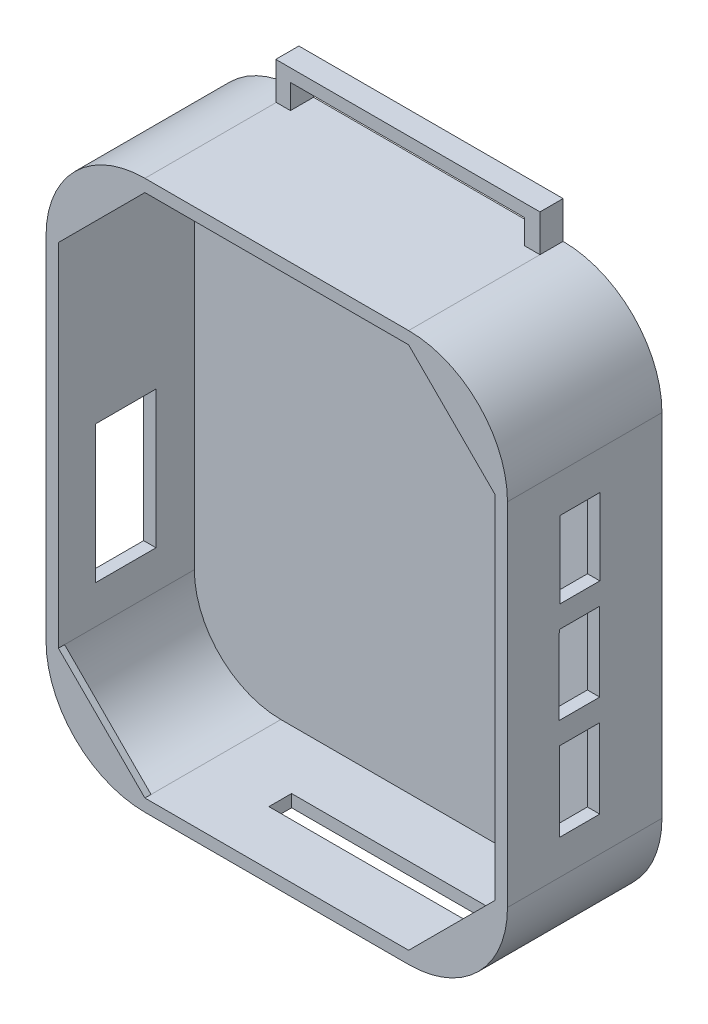
from build123d import *

# Parameters (mm, degrees)
EXTRUDE_2_DEPTH      = 1.5
EXTRUDE_4_DEPTH      = 11
EXTRUDE_START        = -0.5
EXTRUDE_7_DEPTH      = 0.5
EXTRUDE_8_DEPTH      = 0.5
EXTRUDE_9_DEPTH      = 0.5
SKETCH_12_W          = 4.897675457
SKETCH_12_H          = 11.127806736
CUT_EXTRUDE_3_DEPTH  = 3
SKETCH_13_W          = 3.241108758
SKETCH_13_H          = 6.19411896
CUT_EXTRUDE_4_DEPTH  = 3
SKETCH_14_W          = 3.313133397
SKETCH_14_H          = 6.122094321
CUT_EXTRUDE_5_DEPTH  = 3
SKETCH_15_W          = 2.880985563
SKETCH_15_H          = 6.266143599
CUT_EXTRUDE_6_DEPTH  = 3
SKETCH_16_W          = 15.721601541
SKETCH_16_H          = 1.836163931
CUT_EXTRUDE_7_DEPTH  = 3
SKETCH_19_W          = 3.275209086
SKETCH_19_H          = 6.371405254
SKETCH_19_H_2        = 6.414210644
CUT_EXTRUDE_10_DEPTH = 3
EXTRUDE_10_DEPTH     = 0.5
SKETCH_21_W          = 21.34
SKETCH_21_H          = 1.867544815
EXTRUDE_11_DEPTH     = 3
SKETCH_22_W          = 18.717201221
SKETCH_22_H          = 1.991492088
CUT_EXTRUDE_12_DEPTH = 3
SKETCH_23_W          = 21.381625352
SKETCH_23_H          = 3
EXTRUDE_12_DEPTH     = 1.87
SKETCH_24_W          = 18.956438282
SKETCH_24_H          = 1.976854412
CUT_EXTRUDE_13_DEPTH = 1.87


with BuildPart() as part:
    # 草图1 → 凸台-拉伸2 (new body)
    with BuildSketch(Plane.XY):
        with BuildLine():
            Line((-10.67, 22.215), (10.67, 22.215))
            ThreePointArc((10.67, 22.215), (16.326854249, 19.871854249), (18.67, 14.215))
            Line((18.67, 14.215), (18.67, -14.215))
            ThreePointArc((18.67, -14.215), (16.326854249, -19.871854249), (10.67, -22.215))
            Line((10.67, -22.215), (-10.67, -22.215))
            ThreePointArc((-10.67, -22.215), (-16.326854249, -19.871854249), (-18.67, -14.215))
            Line((-18.67, -14.215), (-18.67, 14.215))
            ThreePointArc((-18.67, 14.215), (-16.326854249, 19.871854249), (-10.67, 22.215))
        make_face()
    extrude(amount=EXTRUDE_2_DEPTH)

    # 草图4 → 凸台-拉伸4 (add)
    with BuildSketch(Plane.XY.offset(1.5)):
        with BuildLine():
            Line((18.67, -14.215), (18.67, 14.215))
            ThreePointArc((18.67, 14.215), (16.326854249, 19.871854249), (10.67, 22.215))
            Line((10.67, 22.215), (-10.67, 22.215))
            ThreePointArc((-10.67, 22.215), (-16.326854249, 19.871854249), (-18.67, 14.215))
            Line((-18.67, 14.215), (-18.67, -14.215))
            ThreePointArc((-18.67, -14.215), (-16.326854249, -19.871854249), (-10.67, -22.215))
            Line((-10.67, -22.215), (10.67, -22.215))
            ThreePointArc((10.67, -22.215), (16.326854249, -19.871854249), (18.67, -14.215))
        make_face()
        with BuildLine():
            Line((17.67, -14.215), (17.67, 14.215))
            ThreePointArc((17.67, 14.215), (15.619747468, 19.164747468), (10.67, 21.215))
            Line((10.67, 21.215), (-10.67, 21.215))
            ThreePointArc((-10.67, 21.215), (-15.619747468, 19.164747468), (-17.67, 14.215))
            Line((-17.67, 14.215), (-17.67, -14.215))
            ThreePointArc((-17.67, -14.215), (-15.619747468, -19.164747468), (-10.67, -21.215))
            Line((-10.67, -21.215), (10.67, -21.215))
            ThreePointArc((10.67, -21.215), (15.619747468, -19.164747468), (17.67, -14.215))
        make_face(mode=Mode.SUBTRACT)
    extrude(amount=EXTRUDE_4_DEPTH)

    # 草图8 → 凸台-拉伸7 (add)
    with BuildSketch(Plane.XY.offset(12.5).offset(EXTRUDE_START)):
        with BuildLine():
            Line((-17.67, -14.215), (-10.67, -21.215))
            ThreePointArc((-10.67, -21.215), (-15.619747468, -19.164747468), (-17.67, -14.215))
        make_face()
    extrude(amount=EXTRUDE_7_DEPTH)

    # 草图9 → 凸台-拉伸8 (add)
    with BuildSketch(Plane.XY.offset(12.5).offset(EXTRUDE_START)):
        with BuildLine():
            Line((10.67, 21.215), (17.67, 14.215))
            ThreePointArc((17.67, 14.215), (15.619747468, 19.164747468), (10.67, 21.215))
        make_face()
    extrude(amount=EXTRUDE_8_DEPTH)

    # 草图10 → 凸台-拉伸9 (add)
    with BuildSketch(Plane.XY.offset(12.5).offset(EXTRUDE_START)):
        with BuildLine():
            Line((17.67, -14.215), (10.67, -21.215))
            ThreePointArc((10.67, -21.215), (15.619747468, -19.164747468), (17.67, -14.215))
        make_face()
    extrude(amount=EXTRUDE_9_DEPTH)

    # 草图12 → 切除-拉伸3 (cut)
    with BuildSketch(Plane.ZY.offset(18.67)):
        with Locations((7.050780577, -5.563903368)):
            Rectangle(SKETCH_12_W, SKETCH_12_H)
    extrude(amount=-CUT_EXTRUDE_3_DEPTH, mode=Mode.SUBTRACT)

    # 草图13 → 切除-拉伸4 (cut)
    with BuildSketch(Plane(origin=(18.67, 0, 0), x_dir=(0, 0, -1), z_dir=(1, 0, 0))):
        with Locations((-6.646601976, 8.030747256)):
            Rectangle(SKETCH_13_W, SKETCH_13_H)
    extrude(amount=-CUT_EXTRUDE_4_DEPTH, mode=Mode.SUBTRACT)

    # 草图14 → 切除-拉伸5 (cut)
    with BuildSketch(Plane(origin=(18.67, 0, 0), x_dir=(0, 0, -1), z_dir=(1, 0, 0))):
        with Locations((-6.690937152, -0.144049279)):
            Rectangle(SKETCH_14_W, SKETCH_14_H)
    extrude(amount=-CUT_EXTRUDE_5_DEPTH, mode=Mode.SUBTRACT)

    # 草图15 → 切除-拉伸6 (cut)
    with BuildSketch(Plane(origin=(18.67, 0, 0), x_dir=(0, 0, -1), z_dir=(1, 0, 0))):
        with Locations((-6.664861945, -8.210808854)):
            Rectangle(SKETCH_15_W, SKETCH_15_H)
    extrude(amount=-CUT_EXTRUDE_6_DEPTH, mode=Mode.SUBTRACT)

    # 草图16 → 切除-拉伸7 (cut)
    with BuildSketch(Plane.XZ.offset(22.215)):
        with Locations((2.809199229, 7.168081965)):
            Rectangle(SKETCH_16_W, SKETCH_16_H)
    extrude(amount=-CUT_EXTRUDE_7_DEPTH, mode=Mode.SUBTRACT)

    # 草图19 → 切除-拉伸10 (cut)
    with BuildSketch(Plane(origin=(18.67, 0, 0), x_dir=(0, 0, -1), z_dir=(1, 0, 0))):
        with Locations((-6.671974996, -0.019393812)):
            Rectangle(SKETCH_19_W, SKETCH_19_H)
        with Locations((-6.671974996, -8.200049753)):
            Rectangle(SKETCH_19_W, SKETCH_19_H_2)
    extrude(amount=-CUT_EXTRUDE_10_DEPTH, mode=Mode.SUBTRACT)

    # 草图20 → 凸台-拉伸10 (add)
    with BuildSketch(Plane.XY.offset(12.5).offset(EXTRUDE_START)):
        with BuildLine():
            Line((-10.67, 21.215), (-17.67, 14.215))
            ThreePointArc((-17.67, 14.215), (-15.619747468, 19.164747468), (-10.67, 21.215))
        make_face()
    extrude(amount=EXTRUDE_10_DEPTH)

    # 草图21 → 凸台-拉伸11 (add)
    with BuildSketch(Plane(origin=(0, -22.215, 0), x_dir=(-1, 0, 0), z_dir=(0, -1, 0))):
        with Locations((0, -0.933772408)):
            Rectangle(SKETCH_21_W, SKETCH_21_H)
    extrude(amount=EXTRUDE_11_DEPTH)

    # 草图22 → 切除-拉伸12 (cut)
    with BuildSketch(Plane.XY.offset(1.867544815)):
        with Locations((0.035890498, -23.210746044)):
            Rectangle(SKETCH_22_W, SKETCH_22_H)
    extrude(amount=-CUT_EXTRUDE_12_DEPTH, mode=Mode.SUBTRACT)

    # 草图23 → 凸台-拉伸12 (add)
    with BuildSketch(Plane(origin=(-10.67, -22.215, 0), x_dir=(-1, 0, 0), z_dir=(0, 0, -1))):
        with Locations((-10.649187324, 45.93)):
            Rectangle(SKETCH_23_W, SKETCH_23_H)
    extrude(amount=-EXTRUDE_12_DEPTH)

    # 草图24 → 切除-拉伸13 (cut)
    with BuildSketch(Plane.XY.offset(1.87)):
        with Locations((-0.045973823, 23.203427206)):
            Rectangle(SKETCH_24_W, SKETCH_24_H)
    extrude(amount=-CUT_EXTRUDE_13_DEPTH, mode=Mode.SUBTRACT)


solid = part.part
